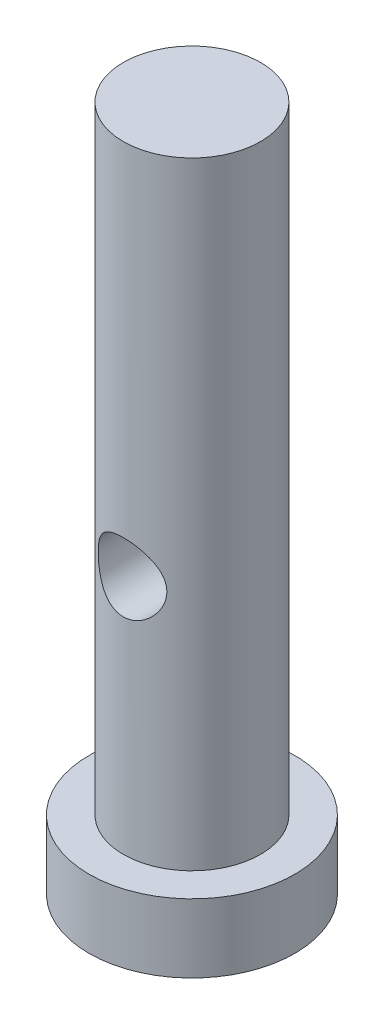
from build123d import *

# Parameters (mm, degrees)
SKETCH1_R               = 7.5
BOSS_EXTRUDE1_DEPTH     = 5
SKETCH2_R               = 5
BOSS_EXTRUDE2_DEPTH     = 45
CUT_EXTRUDE1_DEPTH      = 25
CUT_EXTRUDE1_DEPTH_BACK = 28
SKETCH3_R               = 2.5


with BuildPart() as part:
    # Sketch1 → Boss-Extrude1 (new body)
    with BuildSketch(Plane(origin=(0, 0, 0), x_dir=(1, 0, 0), z_dir=(0, 1, 0))):
        with Locations(Location((0, 0, 0), (0, 0, 270))):
            Circle(SKETCH1_R)
    extrude(amount=BOSS_EXTRUDE1_DEPTH)

    # Sketch2 → Boss-Extrude2 (add)
    with BuildSketch(Plane(origin=(0, 5, 0), x_dir=(1, 0, 0), z_dir=(0, 1, 0))):
        with Locations(Location((0, 0, 0), (0, 0, 90))):
            Circle(SKETCH2_R)
    extrude(amount=BOSS_EXTRUDE2_DEPTH)

    # Sketch3 → Cut-Extrude1 (cut, two sides: drawn at the far end of the back side and taken through both)
    with BuildSketch(Plane.XY.offset(-CUT_EXTRUDE1_DEPTH_BACK)):
        with Locations(Location((0, 22.5, 0), (0, 0, 89.999999974))):
            Circle(SKETCH3_R)
    extrude(amount=CUT_EXTRUDE1_DEPTH + CUT_EXTRUDE1_DEPTH_BACK, mode=Mode.SUBTRACT)


solid = part.part
